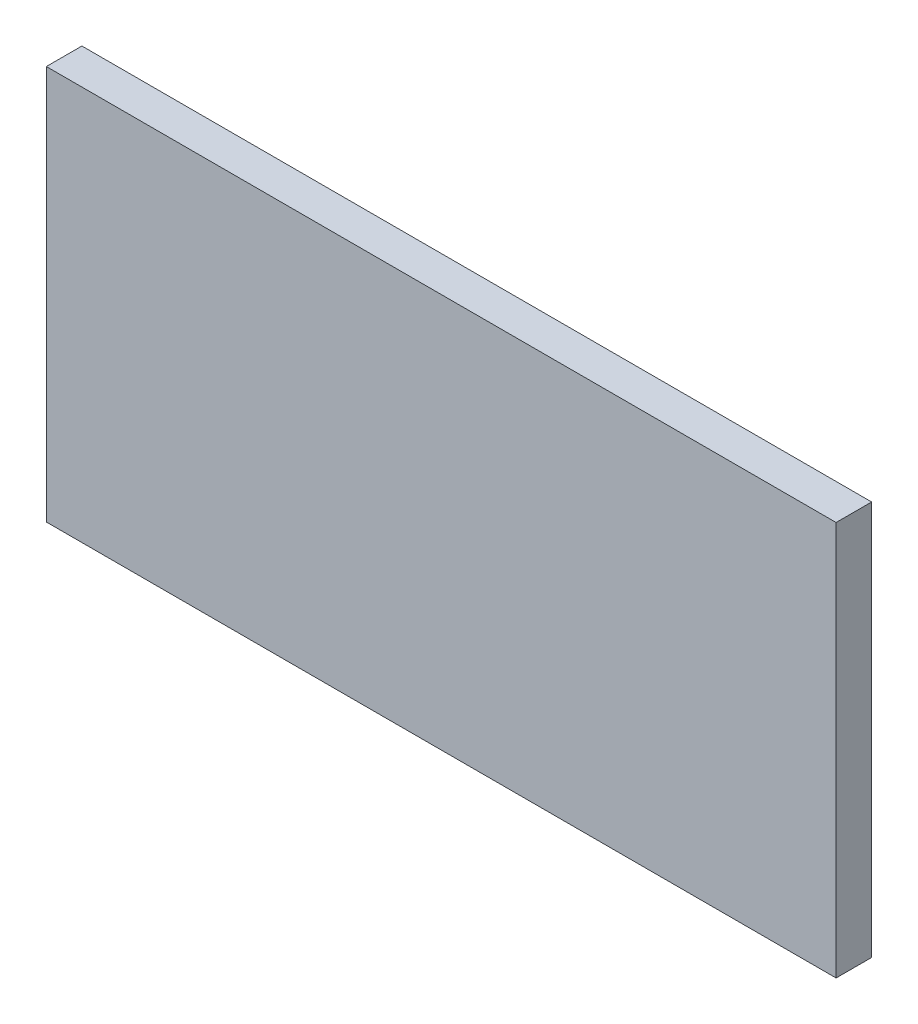
from build123d import *

# Parameters (mm, degrees)
CROQUIS4_W              = 22.221962109
CROQUIS4_H              = 11.1
SALIENTE_EXTRUIR1_DEPTH = 1


with BuildPart() as part:
    # Croquis4 → Saliente-Extruir1 (new body)
    with BuildSketch(Plane.XY.offset(22.9)):
        with Locations((-6.944399686, -4.89796722)):
            Rectangle(CROQUIS4_W, CROQUIS4_H)
    extrude(amount=-SALIENTE_EXTRUIR1_DEPTH)


solid = part.part
